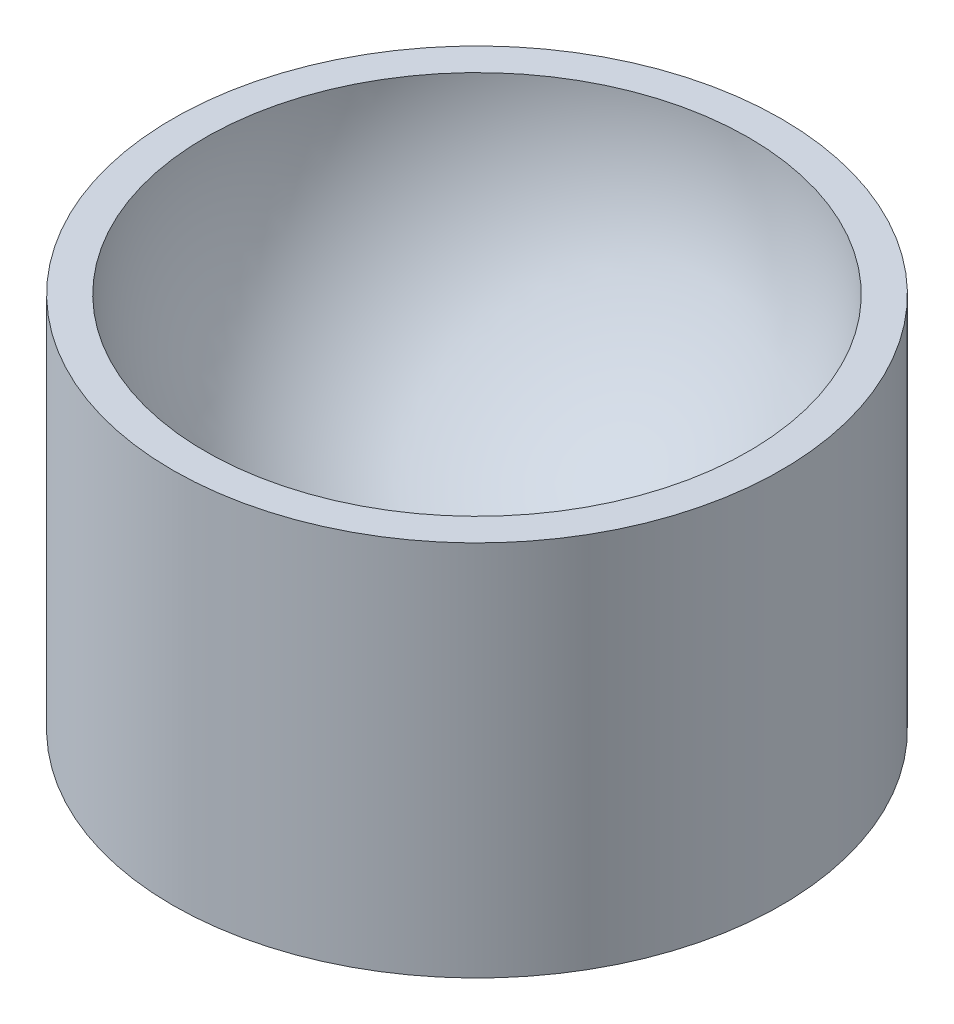
from build123d import *

# Parameters (mm, degrees)
SKETCH2_R           = 42
BOSS_EXTRUDE1_DEPTH = 11.5
SKETCH3_R           = 8
CUT_EXTRUDE1_DEPTH  = 7


with BuildPart() as part:
    # Sketch2 → Boss-Extrude1 (new body)
    with BuildSketch(Plane(origin=(0, 0, 0), x_dir=(1, 0, 0), z_dir=(0, 1, 0))):
        with Locations(Location((0, 0, 0), (0, 0, 270))):
            Circle(SKETCH2_R)
        Polygon((0, 7.505553499), (-6.5, 3.75277675), (-6.5, -3.75277675), (0, -7.505553499), (6.5, -3.75277675), (6.5, 3.75277675), align=None, mode=Mode.SUBTRACT)
    extrude(amount=BOSS_EXTRUDE1_DEPTH)

    # Sketch3 → Cut-Extrude1 (cut)
    with BuildSketch(Plane.XZ):
        with Locations(Location((0, 0, 0), (0, 0, 270))):
            Circle(SKETCH3_R)
    extrude(amount=-CUT_EXTRUDE1_DEPTH, mode=Mode.SUBTRACT)

    # Sketch4 → Revolve1 (revolve)
    with BuildSketch(Plane.XY, mode=Mode.PRIVATE) as revolve1_sk:
        with BuildLine():
            Line((4.05, 14.719341476), (4.05, 11.5))
            Line((4.05, 11.5), (42, 11.5))
            Line((42, 11.5), (42, 52))
            Line((42, 52), (37.5, 52))
            ThreePointArc((37.5, 52), (27.911691099, 26.956288214), (4.05, 14.719341476))
        make_face()
    revolve(revolve1_sk.sketch.rotate(Axis((0, 0, 0), (0, 1, 0)), 90), axis=Axis((0, 0, 0), (0, 1, 0)))


solid = part.part
